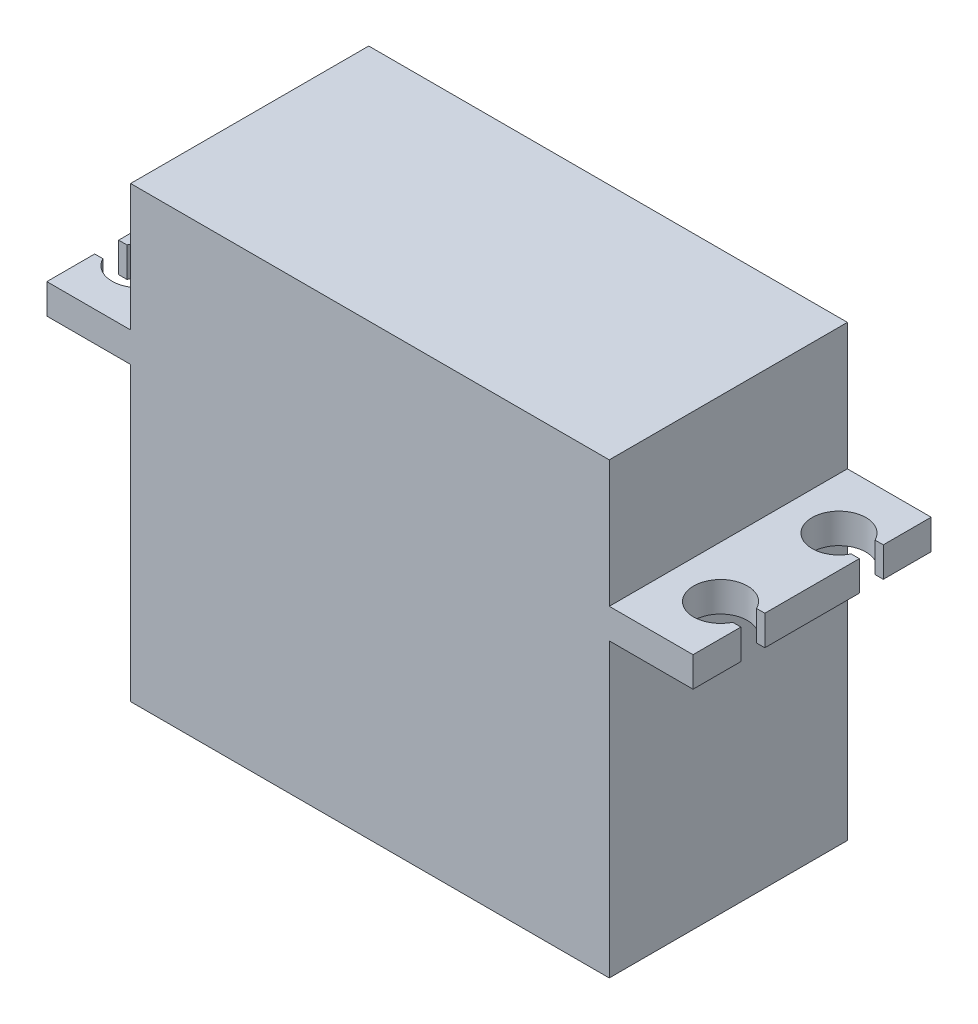
from build123d import *

# Parameters (mm, degrees)
SKETCH_1_W          = 40
SKETCH_1_H          = 37.5
EXTRUDE_1_DEPTH     = 19.9
SKETCH_2_W          = 7
SKETCH_2_H          = 19.9
EXTRUDE_2_DEPTH     = 2.5
CUT_EXTRUDE_1_DEPTH = 43.995581168


with BuildPart() as part:
    # 草图1 → 凸台-拉伸1 (new body)
    with BuildSketch(Plane.XY):
        Rectangle(SKETCH_1_W, SKETCH_1_H)
    extrude(amount=EXTRUDE_1_DEPTH)

    # 草图2 → 凸台-拉伸2 (add)
    with BuildSketch(Plane(origin=(0, 8.15, 0), x_dir=(-1, 0, 0), z_dir=(0, -1, 0))):
        with Locations((23.5, -9.95)):
            Rectangle(SKETCH_2_W, SKETCH_2_H)
        with Locations((-23.5, -9.95)):
            Rectangle(SKETCH_2_W, SKETCH_2_H)
    extrude(amount=EXTRUDE_2_DEPTH)

    # 草图3 → 切除-拉伸1 (cut, through all)
    with BuildSketch(Plane(origin=(0, 8.15, 0), x_dir=(1, 0, 0), z_dir=(0, 1, 0))):
        with BuildLine():
            Line((27, -15.9), (26.315564437, -15.9))
            ThreePointArc((26.315564437, -15.9), (22.05, -14.9), (26.315564437, -13.9))
            Line((26.315564437, -13.9), (27, -13.9))
            Line((27, -13.9), (27, -15.9))
        make_face()
        with BuildLine():
            Line((27, -6), (26.315564437, -6))
            ThreePointArc((26.315564437, -6), (22.05, -5), (26.315564437, -4))
            Line((26.315564437, -4), (27, -4))
            Line((27, -4), (27, -6))
        make_face()
        with BuildLine():
            Line((-27, -15.9), (-27, -13.9))
            Line((-27, -13.9), (-26.315564437, -13.9))
            ThreePointArc((-26.315564437, -13.9), (-22.05, -14.9), (-26.315564437, -15.9))
            Line((-26.315564437, -15.9), (-27, -15.9))
        make_face()
        with BuildLine():
            Line((-27, -4), (-27, -6))
            Line((-27, -6), (-26.315564437, -6))
            ThreePointArc((-26.315564437, -6), (-22.05, -5), (-26.315564437, -4))
            Line((-26.315564437, -4), (-27, -4))
        make_face()
    extrude(amount=-CUT_EXTRUDE_1_DEPTH, mode=Mode.SUBTRACT)


solid = part.part
